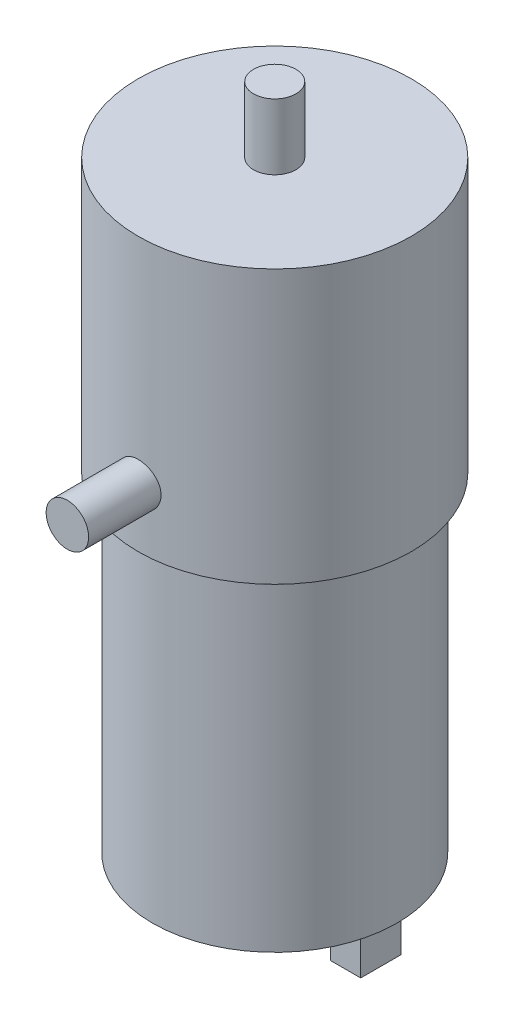
from build123d import *

# Parameters (mm, degrees)
ESQUISSE2_R        = 2.1
BOSS_EXTRU_1_DEPTH = 20.5
ESQUISSE3_W        = 3
ESQUISSE3_H        = 4
BOSS_EXTRU_2_DEPTH = 4.5


with BuildPart() as part:
    # Esquisse1 → Révolution1 (revolve)
    with BuildSketch(Plane.XY, mode=Mode.PRIVATE) as r_volution1_sk:
        with BuildLine():
            Line((0, 33.5), (0, -32.5))
            Line((0, -32.5), (12.1, -32.5))
            Line((12.1, -32.5), (12.1, -1))
            ThreePointArc((12.1, -1), (11.807106781, -0.292893219), (11.1, 0))
            Line((11.1, 0), (13.5, 0))
            Line((13.5, 0), (13.5, 27))
            Line((13.5, 27), (2.1, 27))
            Line((2.1, 27), (2.1, 33.5))
            Line((2.1, 33.5), (0, 33.5))
        make_face()
    revolve(r_volution1_sk.sketch.rotate(Axis((0, 44.171548117, 0), (0, -1, 0)), 90), axis=Axis((0, 44.171548117, 0), (0, -1, 0)))

    # Esquisse2 → Boss.-Extru.1 (add)
    with BuildSketch(Plane.XY):
        with Locations(Location((0, 5.8, 0), (0, 0, 90))):
            Circle(ESQUISSE2_R)
    extrude(amount=BOSS_EXTRU_1_DEPTH)

    # Esquisse3 → Boss.-Extru.2 (add)
    with BuildSketch(Plane.XZ.offset(32.5)):
        with Locations((-9, 0)):
            Rectangle(ESQUISSE3_W, ESQUISSE3_H)
        with Locations((9, 0)):
            Rectangle(ESQUISSE3_W, ESQUISSE3_H)
    extrude(amount=BOSS_EXTRU_2_DEPTH)


solid = part.part
